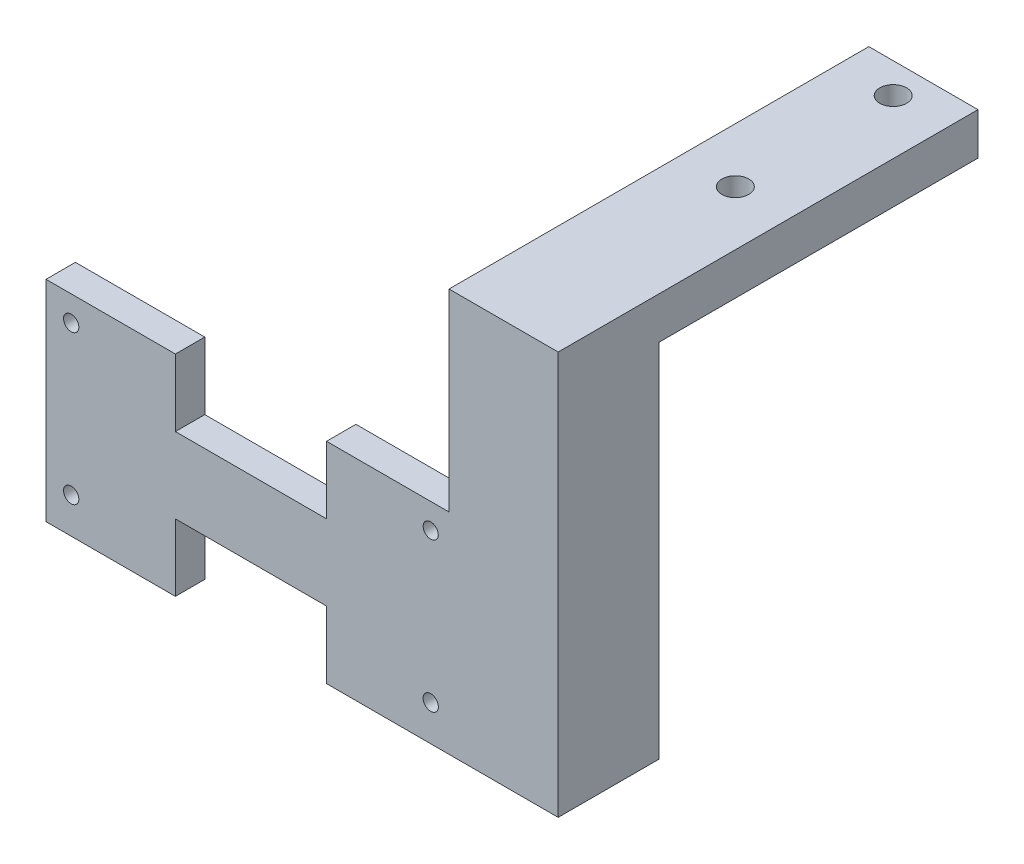
from build123d import *

# Parameters (mm, degrees)
SKETCH_1_W          = 13
SKETCH_1_H          = 26
EXTRUDE_1_DEPTH     = 2.5
SKETCH_2_R          = 1.6
CUT_EXTRUDE_1_DEPTH = 13
SKETCH_3_W          = 13
SKETCH_3_H          = 5
EXTRUDE_2_DEPTH     = 24
SKETCH_4_W          = 13
SKETCH_4_H          = 12
EXTRUDE_3_DEPTH     = 43
SKETCH_5_W          = 3.5
SKETCH_5_H          = 25
EXTRUDE_4_DEPTH     = 48
SKETCH_6_R          = 0.91
SKETCH_6_R_2        = 0.9
CUT_EXTRUDE_2_DEPTH = 16
SKETCH_7_W          = 18
SKETCH_7_H          = 8
CUT_EXTRUDE_3_DEPTH = 16


with BuildPart() as part:
    # 草图1 → 凸台-拉伸1 (new, symmetric)
    with BuildSketch(Plane(origin=(0, 0, 0), x_dir=(1, 0, 0), z_dir=(0, 1, 0))):
        Rectangle(SKETCH_1_W, SKETCH_1_H)
    extrude(amount=EXTRUDE_1_DEPTH, both=True)

    # 草图2 → 切除-拉伸1 (cut)
    with BuildSketch(Plane(origin=(0, 2.5, 0), x_dir=(1, 0, 0), z_dir=(0, 1, 0))):
        with Locations(Location((0, 9.4, 0), (0, 0, 270))):
            Circle(SKETCH_2_R)
        with Locations(Location((0, -9.4, 0), (0, 0, 270))):
            Circle(SKETCH_2_R)
    extrude(amount=-CUT_EXTRUDE_1_DEPTH, mode=Mode.SUBTRACT)

    # 草图3 → 凸台-拉伸2 (add)
    with BuildSketch(Plane.XY.offset(13)):
        Rectangle(SKETCH_3_W, SKETCH_3_H)
    extrude(amount=EXTRUDE_2_DEPTH)

    # 草图4 → 凸台-拉伸3 (add)
    with BuildSketch(Plane.XZ.offset(2.5)):
        with Locations((0, 31)):
            Rectangle(SKETCH_4_W, SKETCH_4_H)
    extrude(amount=EXTRUDE_3_DEPTH)

    # 草图5 → 凸台-拉伸4 (add)
    with BuildSketch(Plane.ZY.offset(6.5)):
        with Locations((35.25, -33)):
            Rectangle(SKETCH_5_W, SKETCH_5_H)
    extrude(amount=EXTRUDE_4_DEPTH)

    # 草图6 → 切除-拉伸2 (cut)
    with BuildSketch(Plane.XY.offset(37)):
        with Locations((-51.5, -23.5)):
            Circle(SKETCH_6_R)
        with Locations((-8.68, -23.5)):
            Circle(SKETCH_6_R_2)
        with Locations((-51.5, -41.24)):
            Circle(SKETCH_6_R)
        with Locations((-8.68, -41.24)):
            Circle(SKETCH_6_R)
    extrude(amount=-CUT_EXTRUDE_2_DEPTH, mode=Mode.SUBTRACT)

    # 草图7 → 切除-拉伸3 (cut)
    with BuildSketch(Plane.XY.offset(37)):
        with Locations((-30.09, -24.5)):
            Rectangle(SKETCH_7_W, SKETCH_7_H)
        with Locations((-30.09, -41.5)):
            Rectangle(SKETCH_7_W, SKETCH_7_H)
    extrude(amount=-CUT_EXTRUDE_3_DEPTH, mode=Mode.SUBTRACT)


solid = part.part
